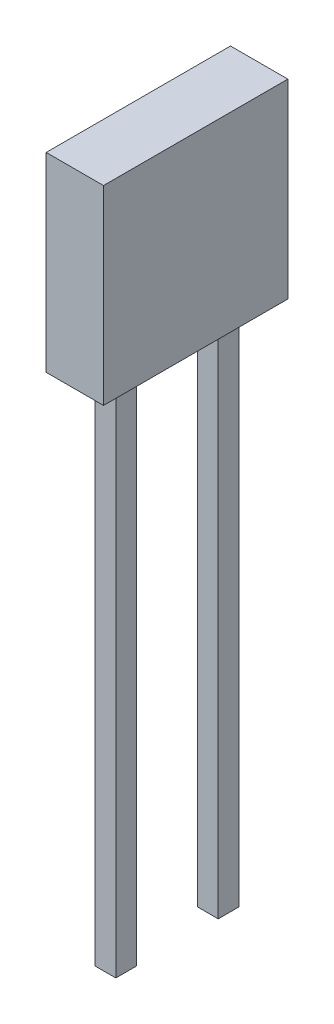
from build123d import *

# Parameters (mm, degrees)
CROQUIS1_W              = 1.4
CROQUIS1_H              = 4.5
SALIENTE_EXTRUIR1_DEPTH = 4.65
CROQUIS2_W              = 0.51
CROQUIS2_H              = 0.51
SALIENTE_EXTRUIR2_DEPTH = 12.7


with BuildPart() as part:
    # Croquis1 → Saliente-Extruir1 (new body)
    with BuildSketch(Plane(origin=(0, 0, 0), x_dir=(1, 0, 0), z_dir=(0, 1, 0))):
        with Locations((0.7, 2.25)):
            Rectangle(CROQUIS1_W, CROQUIS1_H)
    extrude(amount=SALIENTE_EXTRUIR1_DEPTH)

    # Croquis2 → Saliente-Extruir2 (add)
    with BuildSketch(Plane.XZ):
        with Locations((0.7, -1)):
            Rectangle(CROQUIS2_W, CROQUIS2_H)
        with Locations((0.7, -3.5)):
            Rectangle(CROQUIS2_W, CROQUIS2_H)
    extrude(amount=SALIENTE_EXTRUIR2_DEPTH)


solid = part.part
